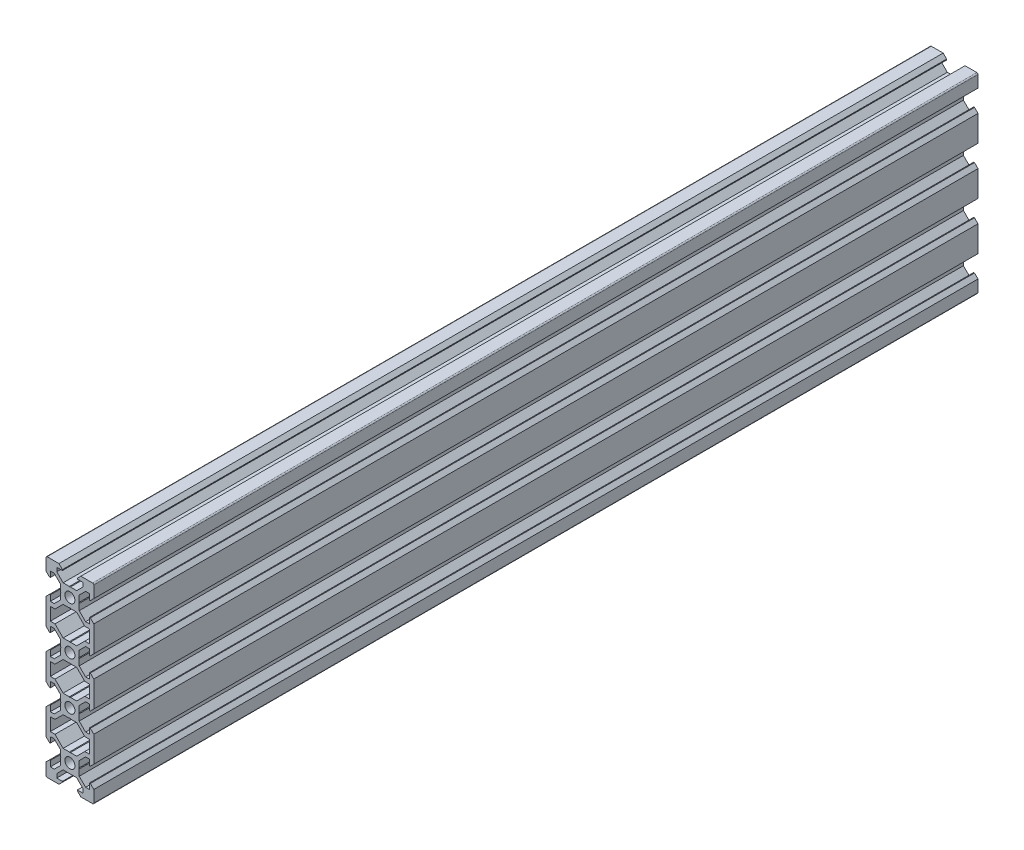
from build123d import *

# Parameters (mm, degrees)
BOSS_EXTRU_1_DEPTH = 370


with BuildPart() as part:
    # Esquisse1 → Boss.-Extru.1 (new body)
    with BuildSketch(Plane.XY):
        with BuildLine():
            Line((-9.5, 10), (-4.58, 10))
            Line((-4.58, 10), (-3.125, 8.545))
            Line((-3.125, 8.545), (-3.125, 8.2))
            Line((-3.125, 8.2), (-5.5, 8.2))
            Line((-5.5, 8.2), (-5.5, 6.560660172))
            Line((-5.5, 6.560660172), (-2.839339828, 3.9))
            Line((-2.839339828, 3.9), (-0.21, 3.9))
            Line((-0.21, 3.9), (0, 3.69))
            Line((0, 3.69), (0, 2.1))
            ThreePointArc((0, 2.1), (-2.1, 0), (0, -2.1))
            Line((0, -2.1), (0, -3.69))
            Line((0, -3.69), (-0.21, -3.9))
            Line((-0.21, -3.9), (-2.839339828, -3.9))
            Line((-2.839339828, -3.9), (-6.239339828, -7.3))
            Line((-6.239339828, -7.3), (-8.2, -7.3))
            Line((-8.2, -7.3), (-8.2, -12.7))
            Line((-8.2, -12.7), (-6.239339828, -12.7))
            Line((-6.239339828, -12.7), (-2.839339828, -16.1))
            Line((-2.839339828, -16.1), (-0.21, -16.1))
            Line((-0.21, -16.1), (0, -16.31))
            Line((0, -16.31), (0, -17.9))
            ThreePointArc((0, -17.9), (-2.1, -20), (0, -22.1))
            Line((0, -22.1), (0, -23.69))
            Line((0, -23.69), (-0.21, -23.9))
            Line((-0.21, -23.9), (-2.839339828, -23.9))
            Line((-2.839339828, -23.9), (-6.239339828, -27.3))
            Line((-6.239339828, -27.3), (-8.2, -27.3))
            Line((-8.2, -27.3), (-8.2, -32.7))
            Line((-8.2, -32.7), (-6.239339828, -32.7))
            Line((-6.239339828, -32.7), (-2.839339828, -36.1))
            Line((-2.839339828, -36.1), (-0.21, -36.1))
            Line((-0.21, -36.1), (0, -36.31))
            Line((0, -36.31), (0, -37.9))
            ThreePointArc((0, -37.9), (-2.1, -40), (0, -42.1))
            Line((0, -42.1), (0, -43.69))
            Line((0, -43.69), (-0.21, -43.9))
            Line((-0.21, -43.9), (-2.839339828, -43.9))
            Line((-2.839339828, -43.9), (-6.239339828, -47.3))
            Line((-6.239339828, -47.3), (-8.2, -47.3))
            Line((-8.2, -47.3), (-8.2, -52.7))
            Line((-8.2, -52.7), (-6.239339828, -52.7))
            Line((-6.239339828, -52.7), (-2.839339828, -56.1))
            Line((-2.839339828, -56.1), (-0.21, -56.1))
            Line((-0.21, -56.1), (0, -56.31))
            Line((0, -56.31), (0, -57.9))
            ThreePointArc((0, -57.9), (-2.1, -60), (0, -62.1))
            Line((0, -62.1), (0, -63.69))
            Line((0, -63.69), (-0.21, -63.9))
            Line((-0.21, -63.9), (-2.839339828, -63.9))
            Line((-2.839339828, -63.9), (-5.5, -66.560660172))
            Line((-5.5, -66.560660172), (-5.5, -68.2))
            Line((-5.5, -68.2), (-3.125, -68.2))
            Line((-3.125, -68.2), (-3.125, -68.545))
            Line((-3.125, -68.545), (-4.58, -70))
            Line((-4.58, -70), (-9.5, -70))
            ThreePointArc((-9.5, -70), (-9.853553391, -69.853553391), (-10, -69.5))
            Line((-10, -69.5), (-10, -64.58))
            Line((-10, -64.58), (-8.545, -63.125))
            Line((-8.545, -63.125), (-8.2, -63.125))
            Line((-8.2, -63.125), (-8.2, -65.5))
            Line((-8.2, -65.5), (-6.560660172, -65.5))
            Line((-6.560660172, -65.5), (-3.9, -62.839339828))
            Line((-3.9, -62.839339828), (-3.9, -60.21))
            Line((-3.9, -60.21), (-3.69, -60))
            Line((-3.69, -60), (-3.9, -59.79))
            Line((-3.9, -59.79), (-3.9, -57.160660172))
            Line((-3.9, -57.160660172), (-6.560660172, -54.5))
            Line((-6.560660172, -54.5), (-8.2, -54.5))
            Line((-8.2, -54.5), (-8.2, -56.875))
            Line((-8.2, -56.875), (-8.545, -56.875))
            Line((-8.545, -56.875), (-10, -55.42))
            Line((-10, -55.42), (-10, -44.58))
            Line((-10, -44.58), (-8.545, -43.125))
            Line((-8.545, -43.125), (-8.2, -43.125))
            Line((-8.2, -43.125), (-8.2, -45.5))
            Line((-8.2, -45.5), (-6.560660172, -45.5))
            Line((-6.560660172, -45.5), (-3.9, -42.839339828))
            Line((-3.9, -42.839339828), (-3.9, -40.21))
            Line((-3.9, -40.21), (-3.69, -40))
            Line((-3.69, -40), (-3.9, -39.79))
            Line((-3.9, -39.79), (-3.9, -37.160660172))
            Line((-3.9, -37.160660172), (-6.560660172, -34.5))
            Line((-6.560660172, -34.5), (-8.2, -34.5))
            Line((-8.2, -34.5), (-8.2, -36.875))
            Line((-8.2, -36.875), (-8.545, -36.875))
            Line((-8.545, -36.875), (-10, -35.42))
            Line((-10, -35.42), (-10, -24.58))
            Line((-10, -24.58), (-8.545, -23.125))
            Line((-8.545, -23.125), (-8.2, -23.125))
            Line((-8.2, -23.125), (-8.2, -25.5))
            Line((-8.2, -25.5), (-6.560660172, -25.5))
            Line((-6.560660172, -25.5), (-3.9, -22.839339828))
            Line((-3.9, -22.839339828), (-3.9, -20.21))
            Line((-3.9, -20.21), (-3.69, -20))
            Line((-3.69, -20), (-3.9, -19.79))
            Line((-3.9, -19.79), (-3.9, -17.160660172))
            Line((-3.9, -17.160660172), (-6.560660172, -14.5))
            Line((-6.560660172, -14.5), (-8.2, -14.5))
            Line((-8.2, -14.5), (-8.2, -16.875))
            Line((-8.2, -16.875), (-8.545, -16.875))
            Line((-8.545, -16.875), (-10, -15.42))
            Line((-10, -15.42), (-10, -4.58))
            Line((-10, -4.58), (-8.545, -3.125))
            Line((-8.545, -3.125), (-8.2, -3.125))
            Line((-8.2, -3.125), (-8.2, -5.5))
            Line((-8.2, -5.5), (-6.560660172, -5.5))
            Line((-6.560660172, -5.5), (-3.9, -2.839339828))
            Line((-3.9, -2.839339828), (-3.9, -0.21))
            Line((-3.9, -0.21), (-3.69, 0))
            Line((-3.69, 0), (-3.9, 0.21))
            Line((-3.9, 0.21), (-3.9, 2.839339828))
            Line((-3.9, 2.839339828), (-6.560660172, 5.5))
            Line((-6.560660172, 5.5), (-8.2, 5.5))
            Line((-8.2, 5.5), (-8.2, 3.125))
            Line((-8.2, 3.125), (-8.545, 3.125))
            Line((-8.545, 3.125), (-10, 4.58))
            Line((-10, 4.58), (-10, 9.5))
            ThreePointArc((-10, 9.5), (-9.853553391, 9.853553391), (-9.5, 10))
        make_face()
    boss_extru_1 = extrude(amount=BOSS_EXTRU_1_DEPTH)

    # Symétrie1: Boss.-Extru.1 across plane
    add(boss_extru_1.mirror(Plane(origin=(0, 3.69, 370), x_dir=(0, 0, 1), z_dir=(-1, 0, 0))))


solid = part.part
